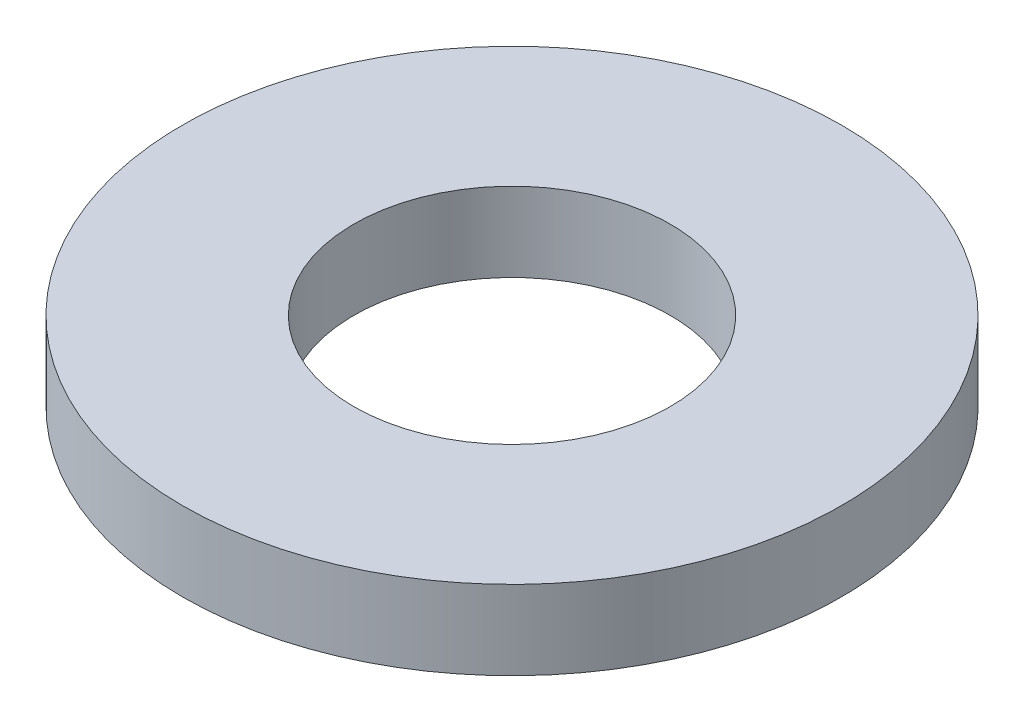
from build123d import *

# Parameters (mm, degrees)
SKETCH1_R           = 12.5
SKETCH1_R_2         = 6
BOSS_EXTRUDE1_DEPTH = 1.5


with BuildPart() as part:
    # Sketch1 → Boss-Extrude1 (new, symmetric)
    with BuildSketch(Plane(origin=(0, 0, 0), x_dir=(1, 0, 0), z_dir=(0, 1, 0))):
        with Locations(Location((0, 0, 0), (0, 0, 270))):
            Circle(SKETCH1_R)
        with Locations(Location((0, 0, 0), (0, 0, 270))):
            Circle(SKETCH1_R_2, mode=Mode.SUBTRACT)
    extrude(amount=BOSS_EXTRUDE1_DEPTH, both=True)


solid = part.part
